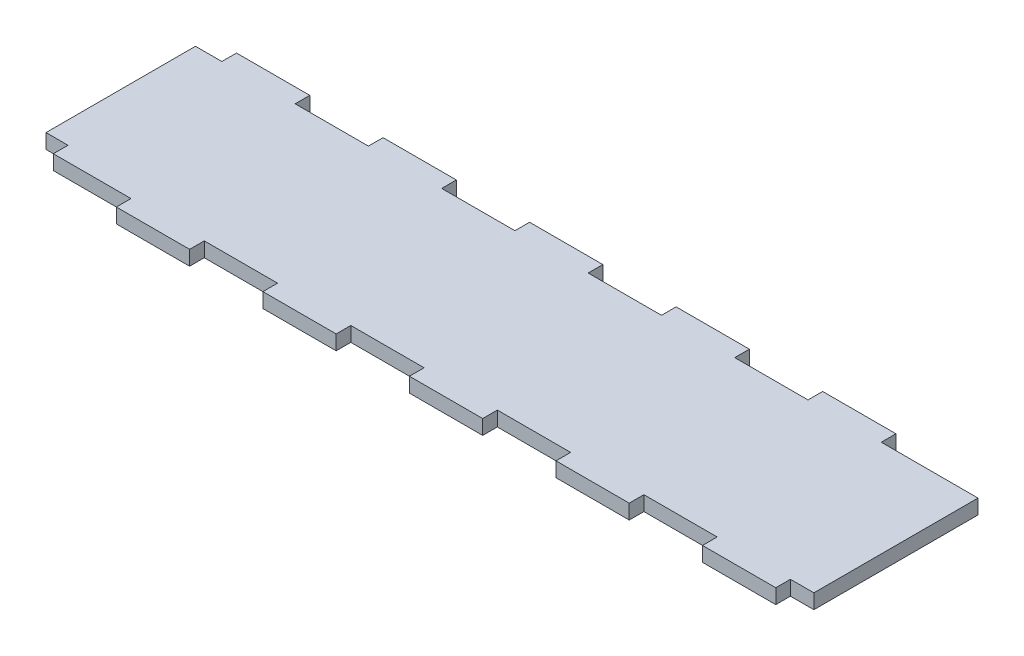
from build123d import *

# Parameters (mm, degrees)
BOSS_EXTRUDE1_DEPTH = 5


with BuildPart() as part:
    # Sketch1 → Boss-Extrude1 (new body)
    with BuildSketch(Plane(origin=(0, 0, 0), x_dir=(1, 0, 0), z_dir=(0, 1, 0))):
        Polygon((50, 56), (25, 56), (25, 61), (0, 61), (0, 56), (-9, 56), (-9, 5), (-1.5, 5), (-1.5, 0), (25, 0), (25, -5), (50, -5), (50, 0), (75, 0), (75, -5), (100, -5), (100, 0), (125, 0), (125, -5), (150, -5), (150, 0), (175, 0), (175, -5), (200, -5), (200, 0), (225, 0), (225, -5), (250, -5), (250, 0), (258, 0), (258, 56), (225, 56), (225, 61), (200, 61), (200, 56), (175, 56), (175, 61), (150, 61), (150, 56), (125, 56), (125, 61), (100, 61), (100, 56), (75, 56), (75, 61), (50, 61), align=None)
    extrude(amount=BOSS_EXTRUDE1_DEPTH)


solid = part.part
